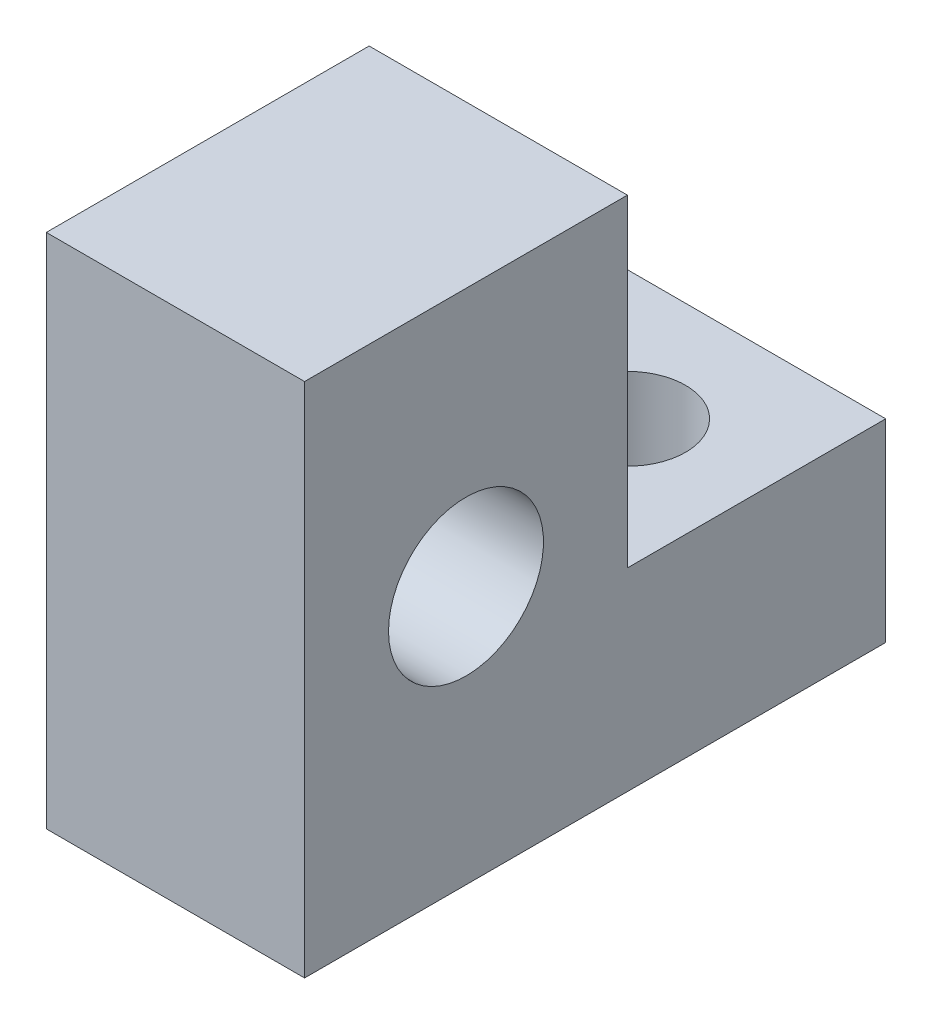
from build123d import *

# Parameters (mm, degrees)
SKETCH1_W                  = 4
SKETCH1_H                  = 5
BOSS_EXTRUDE1_DEPTH        = 4
SKETCH2_W                  = 4
SKETCH2_H                  = 3
BOSS_EXTRUDE2_DEPTH        = 4
M1_6_CLEARANCE_HOLE1_D     = 1.8
M1_6_CLEARANCE_HOLE1_DEPTH = 4
M1_6_CLEARANCE_HOLE1_TIP   = 0.540774557
M2_CLEARANCE_HOLE1_D       = 2.4
M2_CLEARANCE_HOLE1_DEPTH   = 4
M2_CLEARANCE_HOLE1_TIP     = 0.721032743


with BuildPart() as part:
    # Sketch1 → Boss-Extrude1 (new, symmetric)
    with BuildSketch(Plane(origin=(0, 0, 0), x_dir=(1, 0, 0), z_dir=(0, 1, 0))):
        Rectangle(SKETCH1_W, SKETCH1_H)
    extrude(amount=BOSS_EXTRUDE1_DEPTH, both=True)

    # Sketch2 → Boss-Extrude2 (add)
    with BuildSketch(Plane(origin=(0, 0, -2.5), x_dir=(-1, 0, 0), z_dir=(0, 0, -1))):
        with Locations((0, -2.5)):
            Rectangle(SKETCH2_W, SKETCH2_H)
    extrude(amount=BOSS_EXTRUDE2_DEPTH)

    # M1.6 Clearance Hole1
    with Locations(Plane(origin=(0, -1, 0), x_dir=(1, 0, 0), z_dir=(0, 1, 0))):
        with Locations((0, 4.5)):
            Hole(M1_6_CLEARANCE_HOLE1_D / 2, depth=M1_6_CLEARANCE_HOLE1_DEPTH)
            with Locations((0, 0, -(M1_6_CLEARANCE_HOLE1_DEPTH + M1_6_CLEARANCE_HOLE1_TIP / 2))):  # 118° drill point
                Cone(0, M1_6_CLEARANCE_HOLE1_D / 2, M1_6_CLEARANCE_HOLE1_TIP, mode=Mode.SUBTRACT)

    # M2 Clearance Hole1
    with Locations(Plane.ZY.offset(2)):
        with Locations((0, 0)):
            Hole(M2_CLEARANCE_HOLE1_D / 2, depth=M2_CLEARANCE_HOLE1_DEPTH)
            with Locations((0, 0, -(M2_CLEARANCE_HOLE1_DEPTH + M2_CLEARANCE_HOLE1_TIP / 2))):  # 118° drill point
                Cone(0, M2_CLEARANCE_HOLE1_D / 2, M2_CLEARANCE_HOLE1_TIP, mode=Mode.SUBTRACT)


solid = part.part
